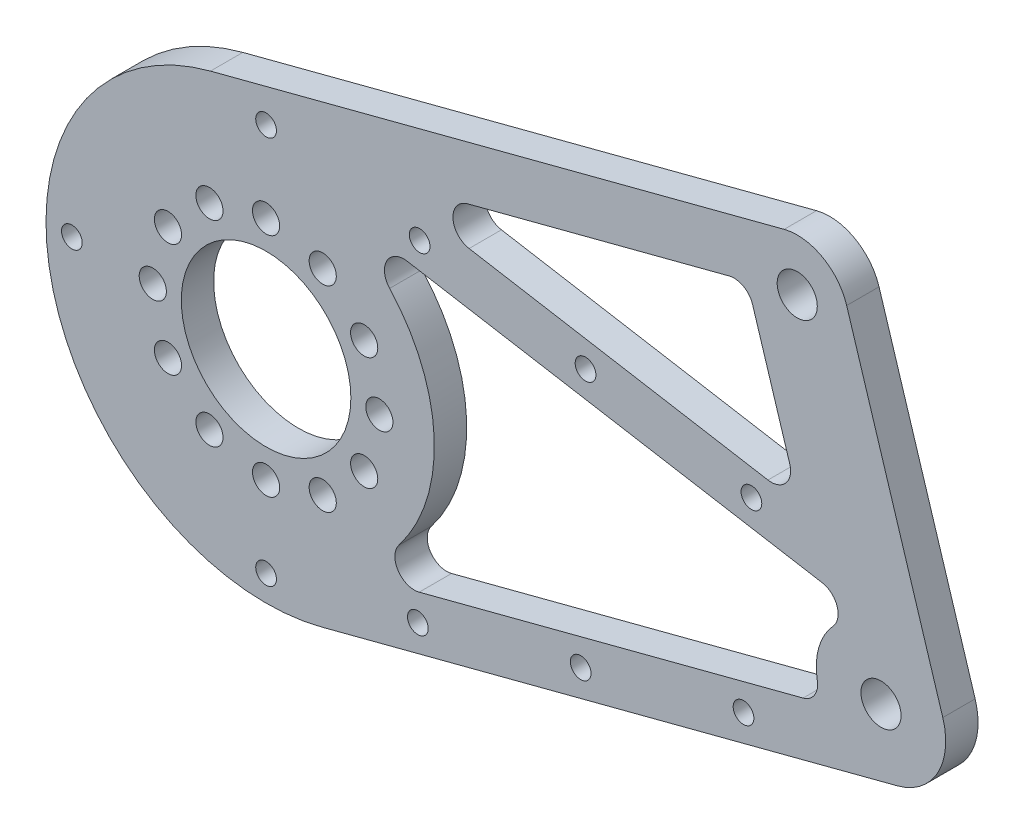
from build123d import *

# Parameters (mm, degrees)
SKETCH_1_R          = 3.1
SKETCH_1_R_2        = 13.1
SKETCH_1_R_3        = 1.6
EXTRUDE_1_DEPTH     = 5
SKETCH_3_R          = 2.1
CUT_EXTRUDE_1_DEPTH = 34
CUT_EXTRUDE_START   = -24
CUT_EXTRUDE_2_DEPTH = 24
FILLET_1_R          = 3
SKETCH_5_R          = 1.6
CUT_EXTRUDE_3_DEPTH = 24
CUT_EXTRUDE_4_DEPTH = 34
FILLET_2_R          = 3


with BuildPart() as part:
    # 草图1 → 凸台-拉伸1 (new body)
    with BuildSketch(Plane.XY):
        with BuildLine():
            Line((-103.589105886, 32.89722268), (-14.961918346, 56.036814298))
            ThreePointArc((-14.961918346, 56.036814298), (-9.057902271, 55.29071215), (-5.302552139, 50.674282835))
            Line((-5.302552139, 50.674282835), (9.548000145, 2.9724894))
            ThreePointArc((9.548000145, 2.9724894), (8.743053177, -4.853763606), (2.526315789, -9.675625485))
            Line((2.526315789, -9.675625485), (-86.410526316, -32.89712665))
            ThreePointArc((-86.410526316, -32.89712665), (-127.897174666, -8.589289785), (-103.589105886, 32.89722268))
        make_face()
        Circle(SKETCH_1_R, mode=Mode.SUBTRACT)
        with Locations((-95, 0)):
            Circle(SKETCH_1_R_2, mode=Mode.SUBTRACT)
        with Locations((-12.940952255, 48.296291314)):
            Circle(SKETCH_1_R, mode=Mode.SUBTRACT)
        with Locations((-95, 30)):
            Circle(SKETCH_1_R_3, mode=Mode.SUBTRACT)
        with Locations((-125, 0)):
            Circle(SKETCH_1_R_3, mode=Mode.SUBTRACT)
        with Locations((-95, -30)):
            Circle(SKETCH_1_R_3, mode=Mode.SUBTRACT)
    extrude(amount=EXTRUDE_1_DEPTH)

    # 草图3 → 切除-拉伸1 (cut)
    with BuildSketch(Plane.XY.offset(5)):
        with Locations((-95, 17.5)):
            Circle(SKETCH_3_R)
        with Locations((-86.25, 15.155444566)):
            Circle(SKETCH_3_R)
        with Locations((-79.844555434, 8.75)):
            Circle(SKETCH_3_R)
        with Locations((-77.5, 0)):
            Circle(SKETCH_3_R)
        with Locations((-79.844555434, -8.75)):
            Circle(SKETCH_3_R)
        with Locations((-86.25, -15.155444566)):
            Circle(SKETCH_3_R)
        with Locations((-95, -17.5)):
            Circle(SKETCH_3_R)
        with Locations((-103.75, -15.155444566)):
            Circle(SKETCH_3_R)
        with Locations((-110.155444566, -8.75)):
            Circle(SKETCH_3_R)
        with Locations((-112.5, 0)):
            Circle(SKETCH_3_R)
        with Locations((-110.155444566, 8.75)):
            Circle(SKETCH_3_R)
        with Locations((-103.75, 15.155444566)):
            Circle(SKETCH_3_R)
    extrude(amount=-CUT_EXTRUDE_1_DEPTH, mode=Mode.SUBTRACT)

    # 草图4 → 切除-拉伸2 (cut)
    with BuildSketch(Plane.XY.offset(5).offset(CUT_EXTRUDE_START)):
        with BuildLine():
            Line((-90.621052632, 25.628593796), (1.684210526, 9.85715146))
            ThreePointArc((1.684210526, 9.85715146), (-8.011191904, 5.985048394), (-8.974874995, -4.410398942))
            Line((-8.974874995, -4.410398942), (-88.431578947, -25.156626262))
            ThreePointArc((-88.431578947, -25.156626262), (-69.024129218, 1.119882624), (-90.621052632, 25.628593796))
        make_face()
    extrude(amount=CUT_EXTRUDE_2_DEPTH, mode=Mode.SUBTRACT)

    # 圆角1
    fillet_1_edges = [part.edges().sort_by_distance(p)[0] for p in [
        (-88.431578947, -25.156626262, 2.5),
        (-90.621052632, 25.628593796, 2.5),
        (1.684210526, 9.85715146, 2.5),
        (-8.974874995, -4.410398942, 2.5),
    ]]
    fillet(fillet_1_edges, radius=FILLET_1_R)

    # 草图5 → 切除-拉伸3 (cut)
    with BuildSketch(Plane.XY.offset(5)):
        with Locations((-71.551753536, -24.883386101)):
            Circle(SKETCH_5_R)
        with Locations((-46.395127275, -18.314965049)):
            Circle(SKETCH_5_R)
        with Locations((-21.238501013, -11.746543996)):
            Circle(SKETCH_5_R)
        with Locations((-71.274432107, 26.380963088)):
            Circle(SKETCH_5_R)
        with Locations((-45.645838312, 22.002015719)):
            Circle(SKETCH_5_R)
        with Locations((-20.017244516, 17.623068351)):
            Circle(SKETCH_5_R)
    extrude(amount=-CUT_EXTRUDE_3_DEPTH, mode=Mode.SUBTRACT)

    # 草图6 → 切除-拉伸4 (cut)
    with BuildSketch(Plane.XY.offset(5)):
        Polygon((-77.356433109, 31.478112128), (-20.689823209, 46.27314566), (-12.641453143, 20.420794919), align=None)
    extrude(amount=-CUT_EXTRUDE_4_DEPTH, mode=Mode.SUBTRACT)

    # 圆角2
    fillet_2_edges = [part.edges().sort_by_distance(p)[0] for p in [
        (-12.641453143, 20.420794919, 2.5),
        (-77.356433109, 31.478112128, 2.5),
        (-20.689823209, 46.27314566, 2.5),
    ]]
    fillet(fillet_2_edges, radius=FILLET_2_R)


solid = part.part
